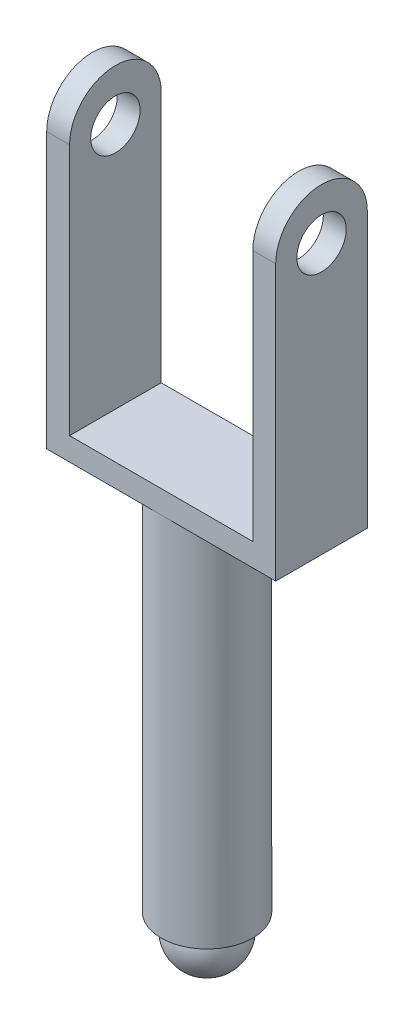
from build123d import *

# Parameters (mm, degrees)
SKETCH_1_R          = 10
SKETCH_1_R_2        = 7.5
EXTRUDE_1_DEPTH     = 80
SKETCH_2_W          = 50
SKETCH_2_H          = 20
EXTRUDE_2_DEPTH     = 70
SKETCH_3_W          = 40
SKETCH_3_H          = 20
CUT_EXTRUDE_1_DEPTH = 65
SKETCH_4_R          = 5.393818753
CUT_EXTRUDE_2_DEPTH = 159.429795178
FILLET_1_RADIUS     = 10
FILLET_1_LENGTH     = 5
FILLET_2_RADIUS     = 10
FILLET_2_LENGTH     = 5
EXTRUDE_START       = 80
SKETCH_5_R          = 7.5
EXTRUDE_3_DEPTH     = 80


with BuildPart() as part:
    # 草图1 → 凸台-拉伸1 (new body)
    with BuildSketch(Plane(origin=(0, 0, 0), x_dir=(1, 0, 0), z_dir=(0, 1, 0))):
        with Locations(Location((0, 0, 0), (0, 0, 270))):
            Circle(SKETCH_1_R)
        with Locations(Location((0, 0, 0), (0, 0, 270))):
            Circle(SKETCH_1_R_2, mode=Mode.SUBTRACT)
    extrude(amount=EXTRUDE_1_DEPTH)

    # 草图2 → 凸台-拉伸2 (add)
    with BuildSketch(Plane(origin=(0, 80, 0), x_dir=(1, 0, 0), z_dir=(0, 1, 0))):
        Rectangle(SKETCH_2_W, SKETCH_2_H)
    extrude(amount=EXTRUDE_2_DEPTH)

    # 草图3 → 切除-拉伸1 (cut)
    with BuildSketch(Plane(origin=(0, 150, 0), x_dir=(1, 0, 0), z_dir=(0, 1, 0))):
        Rectangle(SKETCH_3_W, SKETCH_3_H)
    extrude(amount=-CUT_EXTRUDE_1_DEPTH, mode=Mode.SUBTRACT)

    # 草图4 → 切除-拉伸2 (cut, through all)
    with BuildSketch(Plane.ZY.offset(25)):
        with Locations((0, 138.858219845)):
            Circle(SKETCH_4_R)
    extrude(amount=-CUT_EXTRUDE_2_DEPTH, mode=Mode.SUBTRACT)

    # 圆角1: full round fillet: the end face becomes a half cylinder, R = half its width
    fillet_1_face = Plane((-22.5, 150, 0), x_dir=(1, 0, 0), z_dir=(0, 1, 0))  # on the end face: x along it, z out of the body
    fillet_1_slab = fillet_1_face.offset(-FILLET_1_RADIUS / 2) * Box(FILLET_1_LENGTH, 2 * FILLET_1_RADIUS, FILLET_1_RADIUS, mode=Mode.PRIVATE)  # the body's end, R deep
    fillet_1_round = Plane((-22.5, 140, 0), x_dir=(0, 1, 0), z_dir=(1, 0, 0)) * Cylinder(FILLET_1_RADIUS, FILLET_1_LENGTH, mode=Mode.PRIVATE)  # its axis R under the face
    add(fillet_1_slab - fillet_1_round, mode=Mode.SUBTRACT)

    # 圆角2: full round fillet: the end face becomes a half cylinder, R = half its width
    fillet_2_face = Plane((22.5, 150, 0), x_dir=(-1, 0, 0), z_dir=(0, 1, 0))  # on the end face: x along it, z out of the body
    fillet_2_slab = fillet_2_face.offset(-FILLET_2_RADIUS / 2) * Box(FILLET_2_LENGTH, 2 * FILLET_2_RADIUS, FILLET_2_RADIUS, mode=Mode.PRIVATE)  # the body's end, R deep
    fillet_2_round = Plane((22.5, 140, 0), x_dir=(0, 1, 0), z_dir=(-1, 0, 0)) * Cylinder(FILLET_2_RADIUS, FILLET_2_LENGTH, mode=Mode.PRIVATE)  # its axis R under the face
    add(fillet_2_slab - fillet_2_round, mode=Mode.SUBTRACT)

    # 草图5 → 凸台-拉伸3 (add)
    with BuildSketch(Plane.XZ.offset(-80).offset(EXTRUDE_START)):
        Circle(SKETCH_5_R)
    extrude(amount=-EXTRUDE_3_DEPTH)

    # 草图6 → 旋转1 (revolve)
    with BuildSketch(Plane.XY):
        with BuildLine():
            Line((0, 4.111647453), (0, -10.888352547))
            ThreePointArc((0, -10.888352547), (7.5, -3.388352547), (0, 4.111647453))
        make_face()
    revolve(axis=Axis((0, 4.111647453, 0), (0, -1, 0)))


solid = part.part
